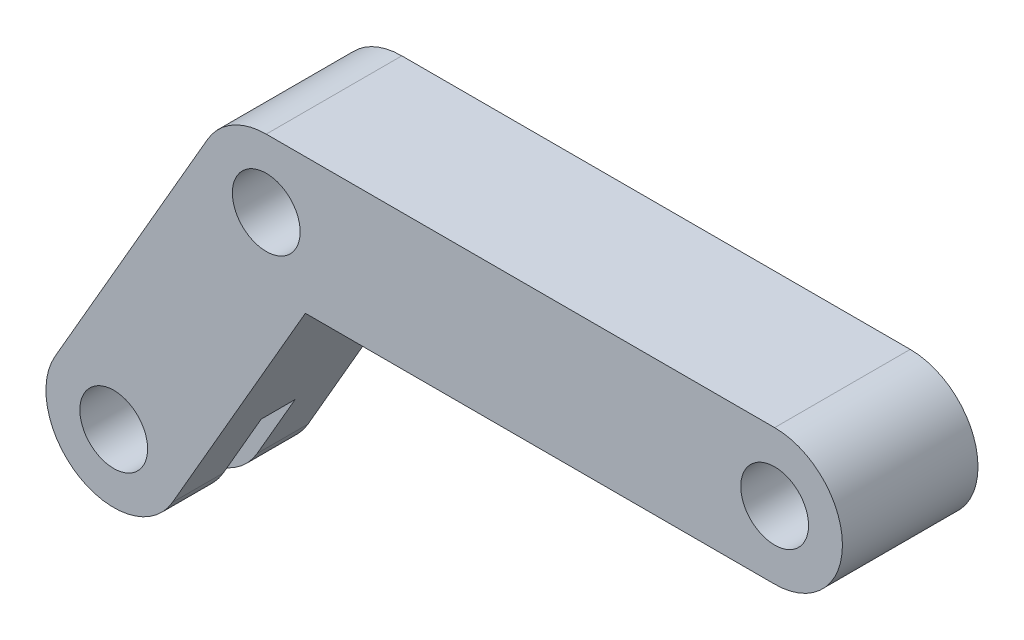
from build123d import *

# Parameters (mm, degrees)
SKETCH1_R           = 5
BOSS_EXTRUDE1_DEPTH = 20
SKETCH4_R           = 15
CUT_EXTRUDE1_DEPTH  = 2.5


with BuildPart() as part:
    # Sketch1 → Boss-Extrude1 (new body)
    with BuildSketch(Plane.XY):
        with BuildLine():
            Line((5.773502692, -10), (75, -10))
            ThreePointArc((75, -10), (85, 0), (75, 10))
            Line((75, 10), (0, 10))
            ThreePointArc((0, 10), (-5, 8.660254038), (-8.660254038, 5))
            Line((-8.660254038, 5), (-31.160254038, -33.97114317))
            ThreePointArc((-31.160254038, -33.97114317), (-27.5, -47.631397208), (-13.839745962, -43.97114317))
            Line((-13.839745962, -43.97114317), (5.773502692, -10))
        make_face()
        with Locations((-22.5, -38.97114317)):
            Circle(SKETCH1_R, mode=Mode.SUBTRACT)
        Circle(SKETCH1_R, mode=Mode.SUBTRACT)
        with Locations((75, 0)):
            Circle(SKETCH1_R, mode=Mode.SUBTRACT)
    extrude(amount=BOSS_EXTRUDE1_DEPTH)

    # Sketch4 → Cut-Extrude1 (cut, symmetric)
    with BuildSketch(Plane(origin=(0, 0, 10), x_dir=(-1, 0, 0), z_dir=(0, 0, -1))):
        with Locations((22.5, -38.97114317)):
            Circle(SKETCH4_R)
    extrude(amount=CUT_EXTRUDE1_DEPTH, both=True, mode=Mode.SUBTRACT)


solid = part.part
